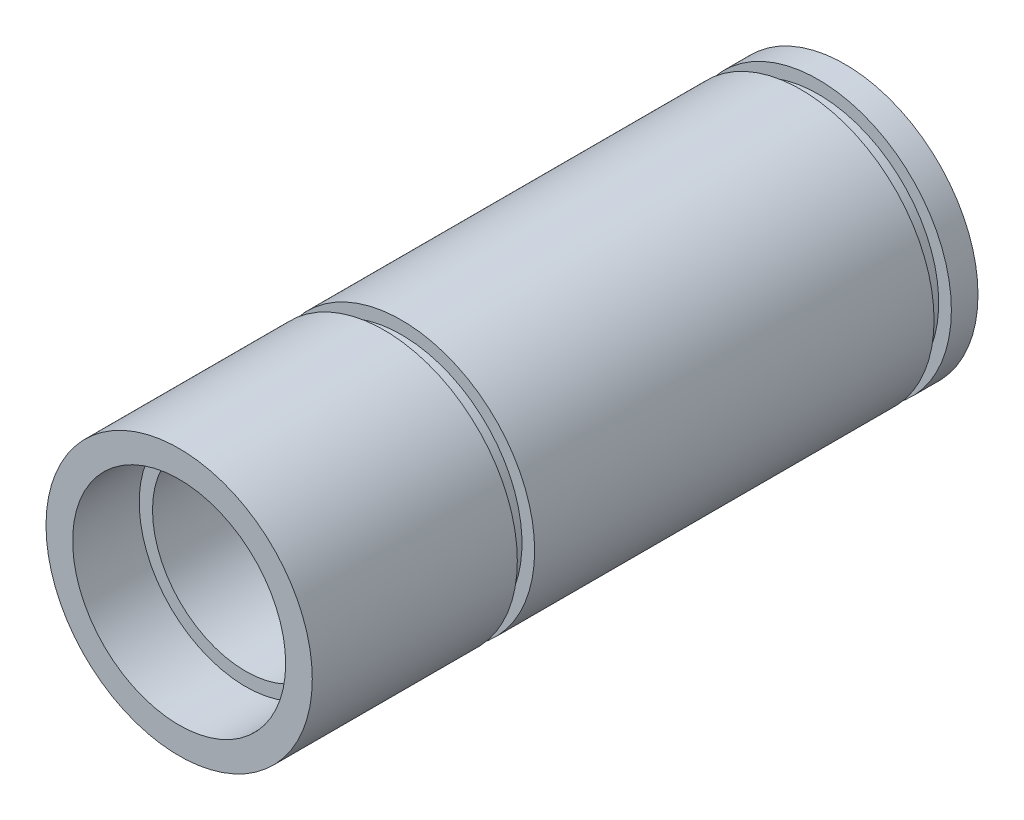
from build123d import *

# Parameters (mm, degrees)
SKETCH1_R          = 10
SKETCH1_R_2        = 7
MAIN_DEPTH         = 50
SKETCH2_R          = 8
BEARING_CUT_DEPTH  = 5
SKETCH5_R          = 10
SKETCH5_R_2        = 9.05
CUT_EXTRUDE2_DEPTH = 1.3
SKETCH6_R          = 10
SKETCH6_R_2        = 9.05
CUT_EXTRUDE3_DEPTH = 1.3


with BuildPart() as part:
    # Sketch1 → Main (new body)
    with BuildSketch(Plane.XY):
        Circle(SKETCH1_R)
        Circle(SKETCH1_R_2, mode=Mode.SUBTRACT)
    extrude(amount=MAIN_DEPTH)

    # Sketch2 → Bearing Cut (cut)
    with BuildSketch(Plane.XY.offset(50)):
        Circle(SKETCH2_R)
    bearing_cut = extrude(amount=-BEARING_CUT_DEPTH, mode=Mode.SUBTRACT)

    # Mirror1: Bearing Cut across plane
    add(bearing_cut.mirror(Plane.XY.offset(25)), mode=Mode.SUBTRACT)

    # Sketch5 → Cut-Extrude2 (cut)
    with BuildSketch(Plane(origin=(0, 0, 2), x_dir=(-1, 0, 0), z_dir=(0, 0, -1))):
        Circle(SKETCH5_R)
        Circle(SKETCH5_R_2, mode=Mode.SUBTRACT)
    extrude(amount=-CUT_EXTRUDE2_DEPTH, mode=Mode.SUBTRACT)

    # Sketch6 → Cut-Extrude3 (cut)
    with BuildSketch(Plane(origin=(0, 0, 33.3), x_dir=(-1, 0, 0), z_dir=(0, 0, -1))):
        Circle(SKETCH6_R)
        Circle(SKETCH6_R_2, mode=Mode.SUBTRACT)
    extrude(amount=-CUT_EXTRUDE3_DEPTH, mode=Mode.SUBTRACT)


solid = part.part
